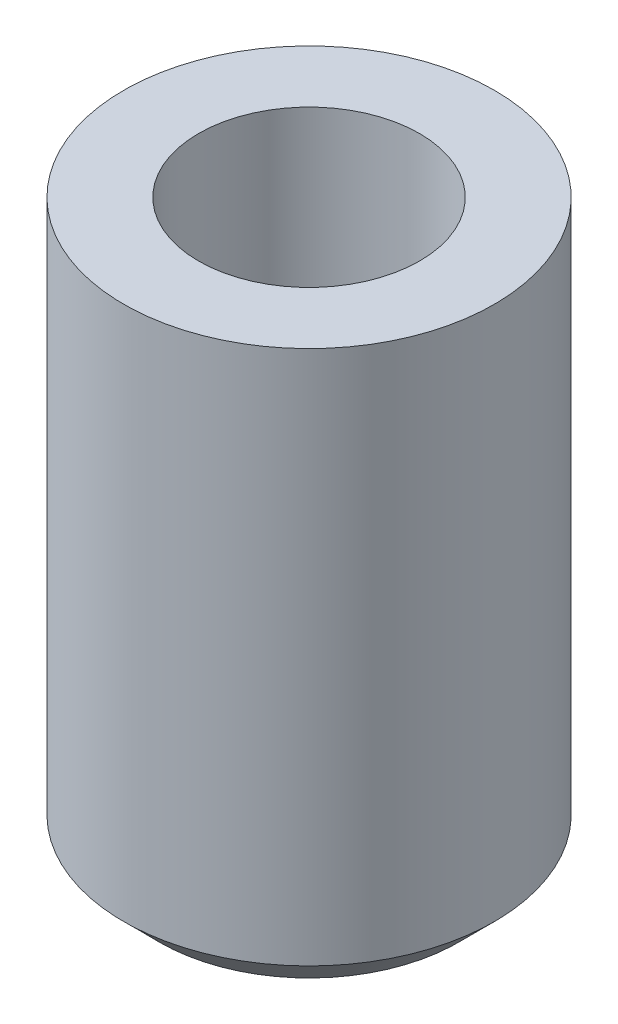
from build123d import *

# Parameters (mm, degrees)
CHAMFER1_SIZE = 0.5


with BuildPart() as part:
    # Sketch2 → Revolve1 (revolve)
    with BuildSketch(Plane(origin=(0, 0, 0), x_dir=(0, 0, -1), z_dir=(1, 0, 0))):
        Polygon((0, 0), (2.6, 0), (2.6, 8), (1.55, 8), (1.55, 2), (0, 2), align=None)
    revolve(axis=Axis((0, 0, 0), (0, 1, 0)))

    # Chamfer1
    chamfer1_edges = [part.edges().sort_by_distance(p)[0] for p in [
        (0, 0, 2.6),
    ]]
    chamfer(chamfer1_edges, length=CHAMFER1_SIZE)


solid = part.part
